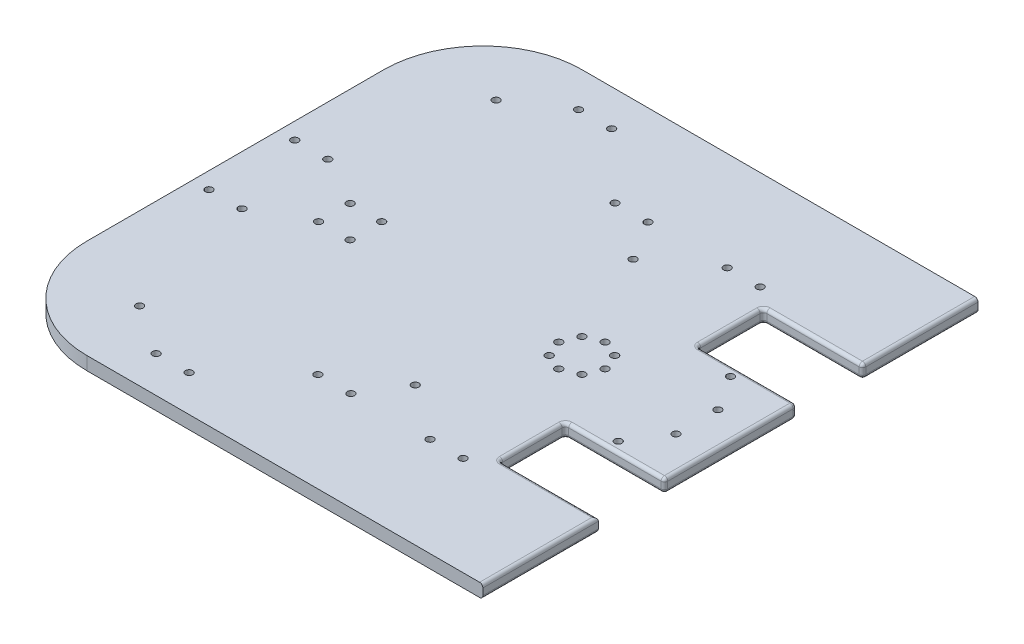
from build123d import *

# Parameters (mm, degrees)
SKETCH_1_W                            = 300
SKETCH_1_H                            = 150
EXTRUDE_1_DEPTH                       = 4
FILLET_4_R                            = 30
FILLET_5_R                            = 30
FILLET_6_R                            = 30
FILLET_7_R                            = 30
HOLE_WIZARD_2_2_2_2_1_D               = 2.2
PATTERN_CIRCULAR_1_COUNT              = 8
MIRROR_1_COPY_1_D                     = 2.2
MIRROR_1_COPY_2_D                     = 2.2
MIRROR_1_COPY_3_D                     = 2.2
MIRROR_1_COPY_4_D                     = 2.2
MIRROR_1_COPY_5_D                     = 2.2
MIRROR_1_COPY_6_D                     = 2.2
MIRROR_1_COPY_7_D                     = 2.2
HOLE_WIZARD_2_2_2_2_2_D               = 2.2
HOLE_WIZARD_2_2_2_2_4_D               = 2.2
F_2_2_2_2_DIAMETER_HOLE1_D            = 2.2
MIRROR_5_AT_THE_SECOND_PLANE_COPY_1_D = 2.2
HOLE_WIZARD_2_2_2_2_6_D               = 2.2
F_2_2_2_2_DIAMETER_HOLE2_D            = 2.2
MIRROR_6_AT_THE_SECOND_PLANE_COPY_1_D = 2.2
F_2_2_2_2_DIAMETER_HOLE3_D            = 2.2
F_2_2_2_2_DIAMETER_HOLE4_D            = 2.2
MIRROR_8_AT_THE_SECOND_PLANE_COPY_1_D = 2.2
F_2_2_2_2_DIAMETER_HOLE5_D            = 2.2
MIRROR_9_AT_THE_SECOND_PLANE_COPY_1_D = 2.2
CUT_EXTRUDE_2_DEPTH                   = 168.752794314
CUT_EXTRUDE_2_DEPTH_BACK              = 168.752794314
SKETCH_25_W                           = 150
SKETCH_25_H                           = 4
SKETCH_29_W                           = 30
SKETCH_29_H                           = 20
CUT_EXTRUDE_3_DEPTH                   = 168.752794314
FILLET_8_R                            = 1


with BuildPart() as part:
    # 草图1 → 凸台-拉伸1 (new body)
    with BuildSketch(Plane(origin=(0, 0, 0), x_dir=(1, 0, 0), z_dir=(0, 1, 0))):
        Rectangle(SKETCH_1_W, SKETCH_1_H)
    extrude(amount=EXTRUDE_1_DEPTH)

    # 圆角4
    fillet_4_edges = [part.edges().sort_by_distance(p)[0] for p in [
        (-150, 2, 75),
    ]]
    fillet(fillet_4_edges, radius=FILLET_4_R)

    # 圆角5
    fillet_5_edges = [part.edges().sort_by_distance(p)[0] for p in [
        (-150, 2, -75),
    ]]
    fillet(fillet_5_edges, radius=FILLET_5_R)

    # 圆角6
    fillet_6_edges = [part.edges().sort_by_distance(p)[0] for p in [
        (150, 2, -75),
    ]]
    fillet(fillet_6_edges, radius=FILLET_6_R)

    # 圆角7
    fillet_7_edges = [part.edges().sort_by_distance(p)[0] for p in [
        (150, 2, 75),
    ]]
    fillet(fillet_7_edges, radius=FILLET_7_R)

    # Ø2.2 (2.2) 直径孔1 (through all)
    with Locations(Plane(origin=(0, 0, 0), x_dir=(-1, 0, 0), z_dir=(0, -1, 0))):
        with Locations((45, -7.02)):
            hole_wizard_2_2_2_2_1 = Hole(HOLE_WIZARD_2_2_2_2_1_D / 2)

    # 阵列(圆周)1: Ø2.2 (2.2) 直径孔1 ×8 about axis
    pattern_circular_1_axis = Axis((-45, 0, 0), (0, 1, 0))
    for i in range(1, PATTERN_CIRCULAR_1_COUNT):
        add(hole_wizard_2_2_2_2_1.rotate(pattern_circular_1_axis, i * 360 / PATTERN_CIRCULAR_1_COUNT), mode=Mode.SUBTRACT)

    # 镜向1: Ø2.2 (2.2) 直径孔1 across plane
    add(hole_wizard_2_2_2_2_1.mirror(Plane(origin=(0, 0, 0), x_dir=(0, 0, 1), z_dir=(1, 0, 0))), mode=Mode.SUBTRACT)

    # 镜向1 copy 1 (through all)
    with Locations(Plane(origin=(13.180194847, 0, -31.819805153), x_dir=(0.7071067811865476, 0, 0.7071067811865475), z_dir=(0, -1, 0))):
        with Locations((45, 7.02)):
            Hole(MIRROR_1_COPY_1_D / 2)

    # 镜向1 copy 2 (through all)
    with Locations(Plane(origin=(45, 0, -45), x_dir=(0, 0, 1), z_dir=(0, -1, 0))):
        with Locations((45, 7.02)):
            Hole(MIRROR_1_COPY_2_D / 2)

    # 镜向1 copy 3 (through all)
    with Locations(Plane(origin=(76.819805153, 0, -31.819805153), x_dir=(-0.7071067811865475, 0, 0.7071067811865476), z_dir=(0, -1, 0))):
        with Locations((45, 7.02)):
            Hole(MIRROR_1_COPY_3_D / 2)

    # 镜向1 copy 4 (through all)
    with Locations(Plane(origin=(90, 0, 0), x_dir=(-1, 0, 0), z_dir=(0, -1, 0))):
        with Locations((45, 7.02)):
            Hole(MIRROR_1_COPY_4_D / 2)

    # 镜向1 copy 5 (through all)
    with Locations(Plane(origin=(76.819805153, 0, 31.819805153), x_dir=(-0.7071067811865477, 0, -0.7071067811865475), z_dir=(0, -1, 0))):
        with Locations((45, 7.02)):
            Hole(MIRROR_1_COPY_5_D / 2)

    # 镜向1 copy 6 (through all)
    with Locations(Plane(origin=(45, 0, 45), x_dir=(0, 0, -1), z_dir=(0, -1, 0))):
        with Locations((45, 7.02)):
            Hole(MIRROR_1_COPY_6_D / 2)

    # 镜向1 copy 7 (through all)
    with Locations(Plane(origin=(13.180194847, 0, 31.819805153), x_dir=(0.7071067811865474, 0, -0.7071067811865477), z_dir=(0, -1, 0))):
        with Locations((45, 7.02)):
            Hole(MIRROR_1_COPY_7_D / 2)

    # Ø2.2 (2.2) 直径孔2 (through all)
    with Locations(Plane(origin=(0, 0, 0), x_dir=(-1, 0, 0), z_dir=(0, -1, 0))):
        with Locations((120, 4.78), (120, -4.775), (110.45, -4.775), (110.45, 4.78)):
            hole_wizard_2_2_2_2_2 = Hole(HOLE_WIZARD_2_2_2_2_2_D / 2)

    # 镜向2: Ø2.2 (2.2) 直径孔2 across plane
    add(hole_wizard_2_2_2_2_2.mirror(Plane(origin=(0, 0, 0), x_dir=(0, 0, 1), z_dir=(1, 0, 0))), mode=Mode.SUBTRACT)

    # Ø2.2 (2.2) 直径孔4 (through all)
    with Locations(Plane(origin=(0, 4, 0), x_dir=(1, 0, 0), z_dir=(0, 1, 0))):
        with Locations((100, -64), (110, -64), (-100, -64), (-110, -64)):
            hole_wizard_2_2_2_2_4 = Hole(HOLE_WIZARD_2_2_2_2_4_D / 2)

    # 镜向4: Ø2.2 (2.2) 直径孔4 across plane
    add(hole_wizard_2_2_2_2_4.mirror(Plane.XY), mode=Mode.SUBTRACT)

    # Ø2.2 (2.2) Diameter Hole1 (through all)
    with Locations(Plane(origin=(0, 4, 0), x_dir=(1, 0, 0), z_dir=(0, 1, 0))):
        with Locations((-125, 54)):
            f_2_2_2_2_diameter_hole1 = Hole(F_2_2_2_2_DIAMETER_HOLE1_D / 2)

    # 镜向5: Ø2.2 (2.2) Diameter Hole1 across plane
    add(f_2_2_2_2_diameter_hole1.mirror(Plane(origin=(0, 0, 0), x_dir=(0, 0, 1), z_dir=(1, 0, 0))), mode=Mode.SUBTRACT)

    # 镜向5 at the second plane: Ø2.2 (2.2) Diameter Hole1 across plane
    add(f_2_2_2_2_diameter_hole1.mirror(Plane.XY), mode=Mode.SUBTRACT)

    # 镜向5 at the second plane copy 1 (through all)
    with Locations(Plane(origin=(0, 4, 0), x_dir=(-1, 0, 0), z_dir=(0, 1, 0))):
        with Locations((-125, 54)):
            Hole(MIRROR_5_AT_THE_SECOND_PLANE_COPY_1_D / 2)

    # Ø2.2 (2.2) 直径孔6 (through all)
    with Locations(Plane(origin=(0, 4, 0), x_dir=(1, 0, 0), z_dir=(0, 1, 0))):
        with Locations((-62.5, 33), (-62.5, -33), (62.5, -33), (62.5, 33)):
            Hole(HOLE_WIZARD_2_2_2_2_6_D / 2)

    # Ø2.2 (2.2) Diameter Hole2 (through all)
    with Locations(Plane(origin=(0, 4, 0), x_dir=(1, 0, 0), z_dir=(0, 1, 0))):
        with Locations((-145, 13), (-135, 13)):
            f_2_2_2_2_diameter_hole2 = Hole(F_2_2_2_2_DIAMETER_HOLE2_D / 2)

    # 镜向6: Ø2.2 (2.2) Diameter Hole2 across plane
    add(f_2_2_2_2_diameter_hole2.mirror(Plane(origin=(0, 0, 0), x_dir=(0, 0, 1), z_dir=(1, 0, 0))), mode=Mode.SUBTRACT)

    # 镜向6 at the second plane: Ø2.2 (2.2) Diameter Hole2 across plane
    add(f_2_2_2_2_diameter_hole2.mirror(Plane.XY), mode=Mode.SUBTRACT)

    # 镜向6 at the second plane copy 1 (through all)
    with Locations(Plane(origin=(0, 4, 0), x_dir=(-1, 0, 0), z_dir=(0, 1, 0))):
        with Locations((-145, 13), (-135, 13)):
            Hole(MIRROR_6_AT_THE_SECOND_PLANE_COPY_1_D / 2)

    # Ø2.2 (2.2) Diameter Hole3 (through all)
    with Locations(Plane(origin=(0, 4, 0), x_dir=(1, 0, 0), z_dir=(0, 1, 0))):
        with Locations((-80, 45), (-70, 45), (-46, 45), (-36, 45), (4, 45), (14, 45), (62, 45), (72, 45)):
            f_2_2_2_2_diameter_hole3 = Hole(F_2_2_2_2_DIAMETER_HOLE3_D / 2)

    # 镜向7: Ø2.2 (2.2) Diameter Hole3 across plane
    add(f_2_2_2_2_diameter_hole3.mirror(Plane.XY), mode=Mode.SUBTRACT)

    # Ø2.2 (2.2) Diameter Hole4 (through all)
    with Locations(Plane.XZ):
        with Locations((-10.16, 6.35)):
            f_2_2_2_2_diameter_hole4 = Hole(F_2_2_2_2_DIAMETER_HOLE4_D / 2)

    # 镜向8: Ø2.2 (2.2) Diameter Hole4 across plane
    add(f_2_2_2_2_diameter_hole4.mirror(Plane.XY), mode=Mode.SUBTRACT)

    # 镜向8 at the second plane: Ø2.2 (2.2) Diameter Hole4 across plane
    add(f_2_2_2_2_diameter_hole4.mirror(Plane(origin=(0, 0, 0), x_dir=(0, 0, 1), z_dir=(1, 0, 0))), mode=Mode.SUBTRACT)

    # 镜向8 at the second plane copy 1 (through all)
    with Locations(Plane(origin=(0, 0, 0), x_dir=(-1, 0, 0), z_dir=(0, -1, 0))):
        with Locations((-10.16, 6.35)):
            Hole(MIRROR_8_AT_THE_SECOND_PLANE_COPY_1_D / 2)

    # Ø2.2 (2.2) Diameter Hole5 (through all)
    with Locations(Plane(origin=(0, 4, 0), x_dir=(1, 0, 0), z_dir=(0, 1, 0))):
        with Locations((-17, 17)):
            f_2_2_2_2_diameter_hole5 = Hole(F_2_2_2_2_DIAMETER_HOLE5_D / 2)

    # 镜向9: Ø2.2 (2.2) Diameter Hole5 across plane
    add(f_2_2_2_2_diameter_hole5.mirror(Plane.XY), mode=Mode.SUBTRACT)

    # 镜向9 at the second plane: Ø2.2 (2.2) Diameter Hole5 across plane
    add(f_2_2_2_2_diameter_hole5.mirror(Plane(origin=(0, 0, 0), x_dir=(0, 0, 1), z_dir=(1, 0, 0))), mode=Mode.SUBTRACT)

    # 镜向9 at the second plane copy 1 (through all)
    with Locations(Plane(origin=(0, 4, 0), x_dir=(-1, 0, 0), z_dir=(0, 1, 0))):
        with Locations((-17, 17)):
            Hole(MIRROR_9_AT_THE_SECOND_PLANE_COPY_1_D / 2)

    # 草图25 → 切除-拉伸2 (cut, two sides: drawn at the far end of the back side and taken through both)
    with BuildSketch(Plane.XY.offset(-CUT_EXTRUDE_2_DEPTH_BACK)):
        with Locations((75, 2)):
            Rectangle(SKETCH_25_W, SKETCH_25_H)
    extrude(amount=CUT_EXTRUDE_2_DEPTH + CUT_EXTRUDE_2_DEPTH_BACK, mode=Mode.SUBTRACT)

    # 草图29 → 切除-拉伸3 (cut, through all)
    with BuildSketch(Plane(origin=(0, 4, 0), x_dir=(1, 0, 0), z_dir=(0, 1, 0))):
        with Locations((-15, 30)):
            Rectangle(SKETCH_29_W, SKETCH_29_H)
    cut_extrude_3 = extrude(amount=-CUT_EXTRUDE_3_DEPTH, mode=Mode.SUBTRACT)

    # 镜向10: 切除-拉伸3 across plane
    add(cut_extrude_3.mirror(Plane.XY), mode=Mode.SUBTRACT)

    # 圆角8
    fillet_8_edges = [part.edges().sort_by_distance(p)[0] for p in [
        (0, 4, -57.5),
        (0, 0, -57.5),
        (0, 0, 0),
        (0, 4, 0),
        (-30, 0, -30),
        (-30, 2, -20),
        (-15, 0, -40),
        (-30, 2, -40),
        (0, 2, -40),
        (-15, 0, -20),
        (0, 2, -20),
        (-30, 4, -30),
        (-15, 4, -20),
        (-15, 4, -40),
        (0, 0, 57.5),
        (0, 4, 57.5),
        (-30, 4, 30),
        (-30, 2, 40),
        (-15, 4, 20),
        (-30, 2, 20),
        (0, 2, 20),
        (-15, 4, 40),
        (-30, 0, 30),
        (-15, 0, 20),
        (-15, 0, 40),
    ]]
    fillet(fillet_8_edges, radius=FILLET_8_R)


solid = part.part
